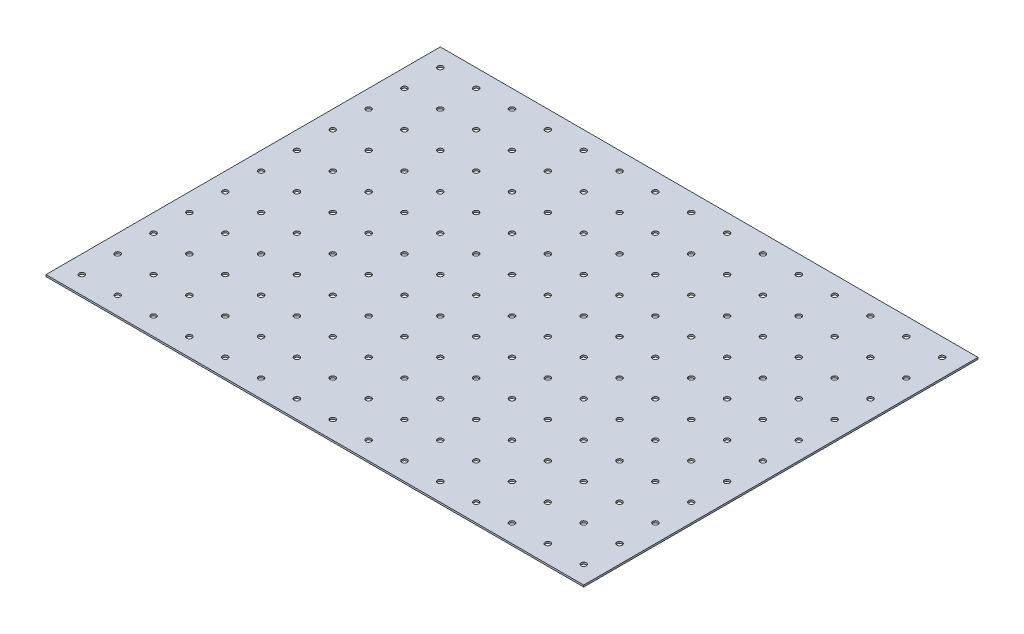
from build123d import *

# Parameters (mm, degrees)
SKETCH1_W            = 300
SKETCH1_H            = 220
BOSS_EXTRUDE1_DEPTH  = 1
SKETCH2_R            = 1.5
CUT_EXTRUDE1_DEPTH   = 1
LPATTERN1_COUNT      = 15
LPATTERN1_PITCH      = 20
LPATTERN1_COUNT_DIR2 = 11
LPATTERN1_PITCH_DIR2 = 20


with BuildPart() as part:
    # Sketch1 → Boss-Extrude1 (new body)
    with BuildSketch(Plane(origin=(0, 0, 0), x_dir=(1, 0, 0), z_dir=(0, 1, 0))):
        with Locations((57.055961071, -67.177615572)):
            Rectangle(SKETCH1_W, SKETCH1_H)
    extrude(amount=BOSS_EXTRUDE1_DEPTH)

    # Sketch2 → Cut-Extrude1 (cut)
    with BuildSketch(Plane(origin=(0, 1, 0), x_dir=(1, 0, 0), z_dir=(0, 1, 0))):
        with Locations(Location((-82.944038929, 32.822384428, 0), (0, 0, 270))):
            Circle(SKETCH2_R)
    cut_extrude1 = extrude(amount=-CUT_EXTRUDE1_DEPTH, mode=Mode.SUBTRACT)

    # LPattern1: Cut-Extrude1 15 × 11
    with Locations(*[(i * LPATTERN1_PITCH, 0, j * LPATTERN1_PITCH_DIR2) for i in range(LPATTERN1_COUNT) for j in range(LPATTERN1_COUNT_DIR2) if (i, j) != (0, 0)]):
        add(cut_extrude1, mode=Mode.SUBTRACT)


solid = part.part
